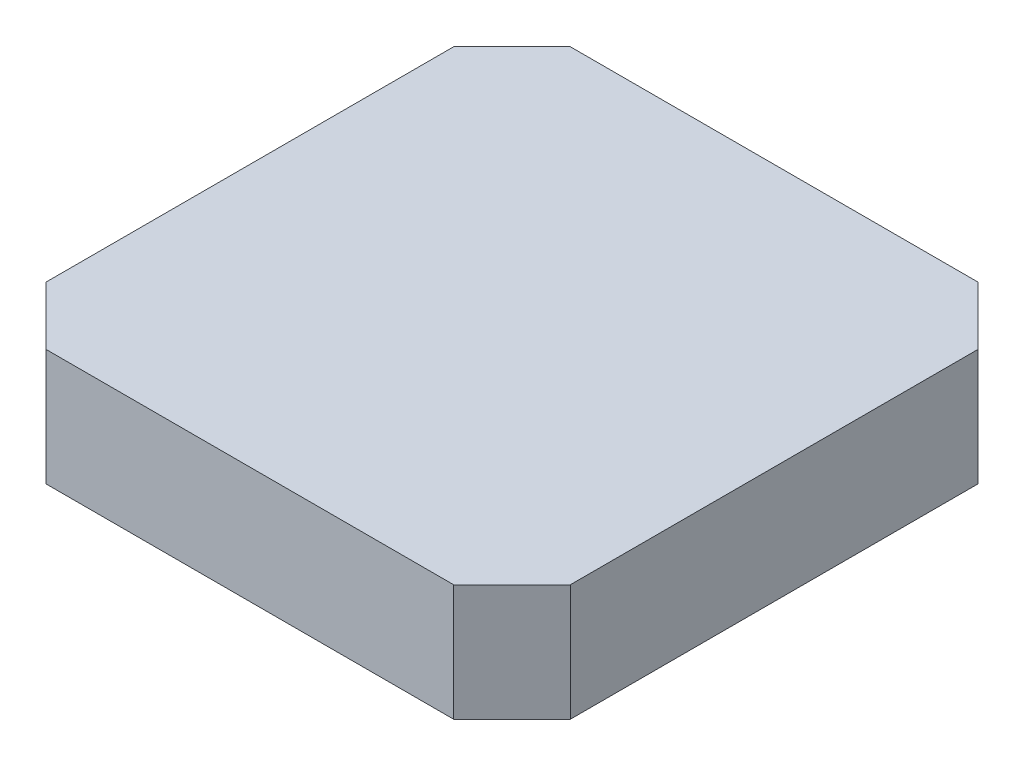
from build123d import *

# Parameters (mm, degrees)
SKETCH1_W           = 114.3
SKETCH1_H           = 114.3
BOSS_EXTRUDE1_DEPTH = 25.4
CHAMFER1_SIZE       = 12.7
SKETCH2_R           = 6.35
CUT_EXTRUDE1_DEPTH  = 5.08


with BuildPart() as part:
    # Sketch1 → Boss-Extrude1 (new body)
    with BuildSketch(Plane(origin=(0, 0, 0), x_dir=(1, 0, 0), z_dir=(0, 1, 0))):
        Rectangle(SKETCH1_W, SKETCH1_H)
    extrude(amount=BOSS_EXTRUDE1_DEPTH)

    # Chamfer1
    chamfer1_edges = [part.edges().sort_by_distance(p)[0] for p in [
        (57.15, 12.7, 57.15),
        (-57.15, 12.7, 57.15),
        (-57.15, 12.7, -57.15),
        (57.15, 12.7, -57.15),
    ]]
    chamfer(chamfer1_edges, length=CHAMFER1_SIZE)

    # Sketch2 → Cut-Extrude1 (cut)
    with BuildSketch(Plane(origin=(0, 0, 0), x_dir=(-1, 0, 0), z_dir=(0, -1, 0))):
        with Locations(Location((0, -47.625, 0), (0, 0, 90))):
            Circle(SKETCH2_R)
    extrude(amount=-CUT_EXTRUDE1_DEPTH, mode=Mode.SUBTRACT)


solid = part.part
